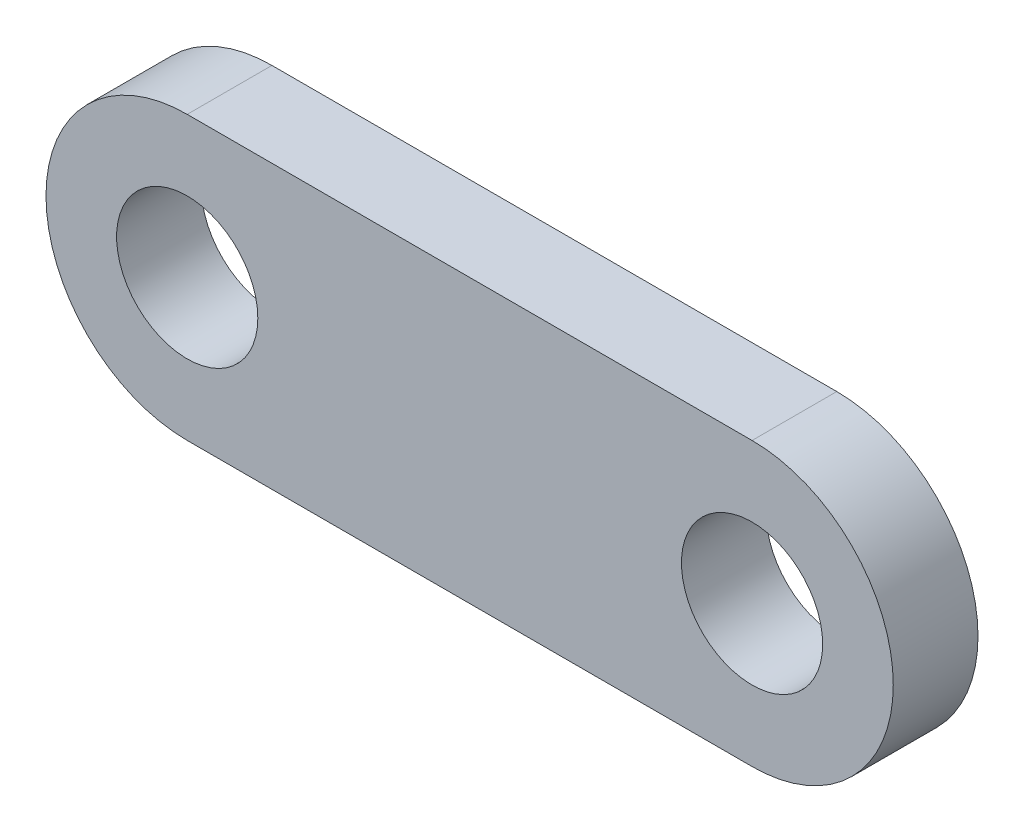
from build123d import *

# Parameters (mm, degrees)
SKETCH1_R           = 2.5
BOSS_EXTRUDE1_DEPTH = 3


with BuildPart() as part:
    # Sketch1 → Boss-Extrude1 (new body)
    with BuildSketch(Plane.XY):
        with BuildLine():
            Line((-10, 5), (10, 5))
            ThreePointArc((10, 5), (15, 0), (10, -5))
            Line((10, -5), (-10, -5))
            ThreePointArc((-10, -5), (-15, 0), (-10, 5))
        make_face()
        with Locations((-10, 0)):
            Circle(SKETCH1_R, mode=Mode.SUBTRACT)
        with Locations((10, 0)):
            Circle(SKETCH1_R, mode=Mode.SUBTRACT)
    extrude(amount=BOSS_EXTRUDE1_DEPTH)


solid = part.part
